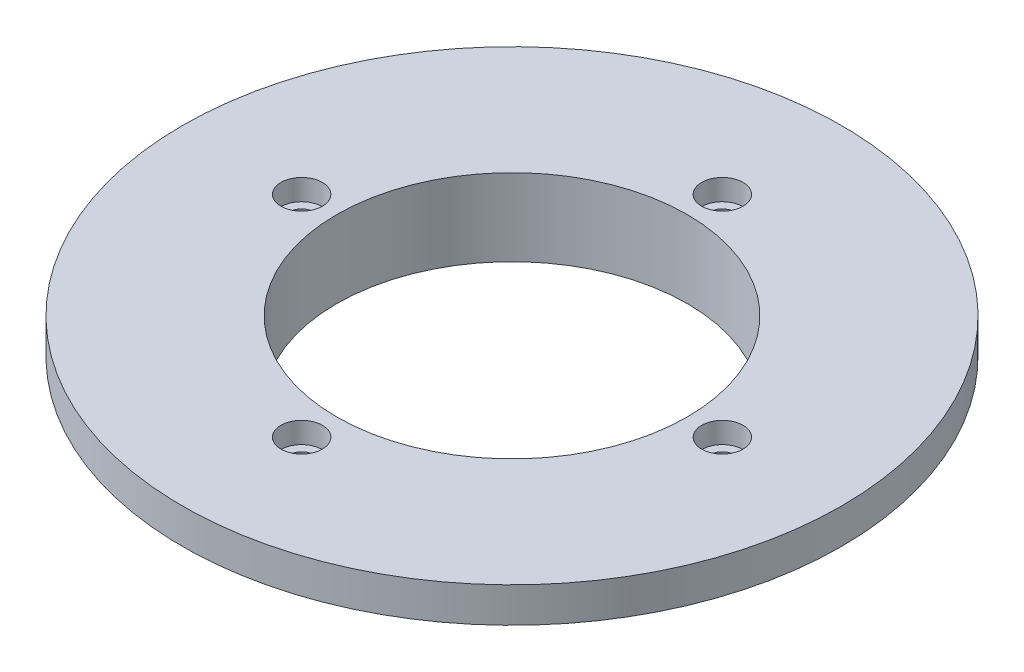
from build123d import *

# Parameters (mm, degrees)
SKETCH3_R          = 1.7
CUT_EXTRUDE1_DEPTH = 68.372101051
CIRPATTERN1_COUNT  = 4
SKETCH4_R          = 2.95
CUT_EXTRUDE2_DEPTH = 3
CIRPATTERN2_COUNT  = 4


with BuildPart() as part:
    # Sketch1 → Revolve1 (revolve)
    with BuildSketch(Plane.XY):
        Polygon((25, 0), (47, 0), (47, -5), (35, -5), (35, -11), (25, -11), align=None)
    revolve(axis=Axis((0, -62.255842479, 0), (0, 1, 0)))

    # Sketch3 → Cut-Extrude1 (cut, symmetric)
    with BuildSketch(Plane(origin=(0, 0, 0), x_dir=(1, 0, 0), z_dir=(0, 1, 0))):
        with Locations(Location((0, 30, 0), (0, 0, 180))):
            Circle(SKETCH3_R)
    cut_extrude1 = extrude(amount=CUT_EXTRUDE1_DEPTH, both=True, mode=Mode.SUBTRACT)

    # CirPattern1: Cut-Extrude1 ×4 about axis
    cirpattern1_axis = Axis((0, 0, 0), (0, 1, 0))
    for i in range(1, CIRPATTERN1_COUNT):
        add(cut_extrude1.rotate(cirpattern1_axis, i * 360 / CIRPATTERN1_COUNT), mode=Mode.SUBTRACT)

    # Sketch4 → Cut-Extrude2 (cut)
    with BuildSketch(Plane(origin=(0, 0, 0), x_dir=(1, 0, 0), z_dir=(0, 1, 0))):
        with Locations(Location((0, 30, 0), (0, 0, 180))):
            Circle(SKETCH4_R)
    cut_extrude2 = extrude(amount=-CUT_EXTRUDE2_DEPTH, mode=Mode.SUBTRACT)

    # CirPattern2: Cut-Extrude2 ×4 about axis
    cirpattern2_axis = Axis((0, 0, 0), (0, 1, 0))
    for i in range(1, CIRPATTERN2_COUNT):
        add(cut_extrude2.rotate(cirpattern2_axis, i * 360 / CIRPATTERN2_COUNT), mode=Mode.SUBTRACT)


solid = part.part
